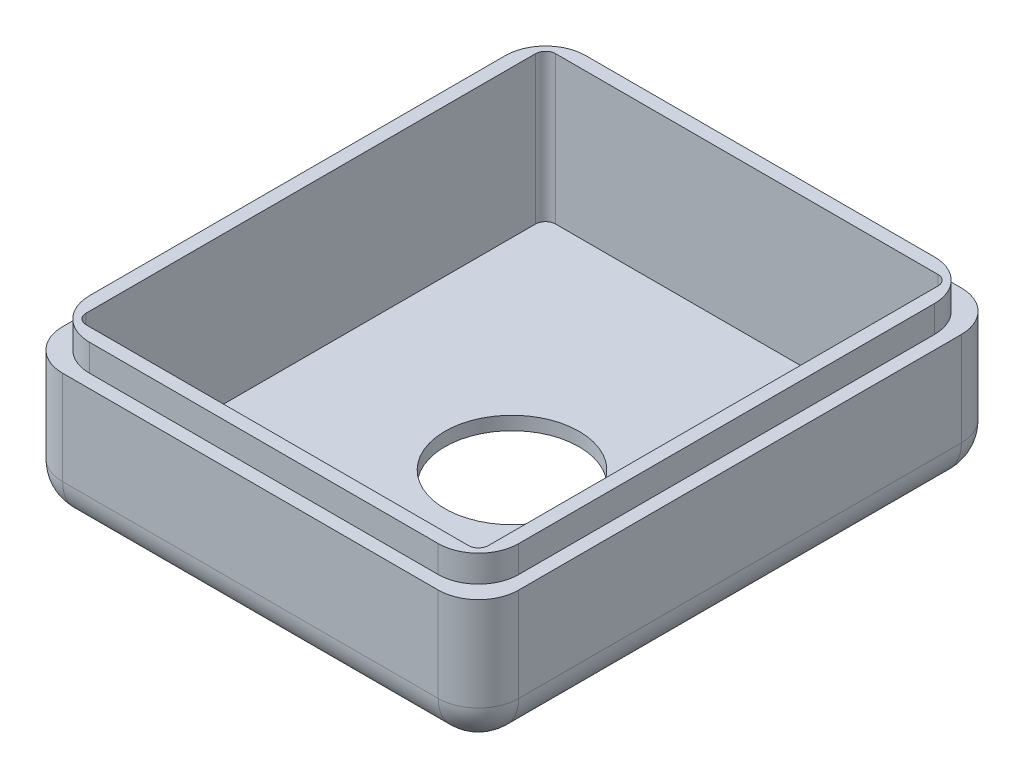
from build123d import *

# Parameters (mm, degrees)
SCHIZZO1_W                   = 34
SCHIZZO1_H                   = 39
ESTRUSIONE_ESTRUSIONE1_DEPTH = 10
SCHIZZO4_W                   = 32
SCHIZZO4_H                   = 37
ESTRUSIONE_ESTRUSIONE2_DEPTH = 2
SCHIZZO5_W                   = 30
SCHIZZO5_H                   = 35
TAGLIO_ESTRUSIONE2_DEPTH     = 11
RACCORDO1_R                  = 3
RACCORDO2_R                  = 0.75
TAGLIO_ESTRUSIONE3_REACH     = 47.879
SCHIZZO6_R                   = 5


with BuildPart() as part:
    # Schizzo1 → Estrusione-Estrusione1 (new body)
    with BuildSketch(Plane(origin=(0, 0, 0), x_dir=(1, 0, 0), z_dir=(0, 1, 0))):
        with Locations((-16.306007172, -9.682590788)):
            Rectangle(SCHIZZO1_W, SCHIZZO1_H)
    extrude(amount=ESTRUSIONE_ESTRUSIONE1_DEPTH)

    # Schizzo4 → Estrusione-Estrusione2 (add)
    with BuildSketch(Plane(origin=(0, 10, 0), x_dir=(1, 0, 0), z_dir=(0, 1, 0))):
        with Locations((-16.306007172, -9.682590788)):
            Rectangle(SCHIZZO4_W, SCHIZZO4_H)
    extrude(amount=ESTRUSIONE_ESTRUSIONE2_DEPTH)

    # Schizzo5 → Taglio-Estrusione2 (cut)
    with BuildSketch(Plane(origin=(0, 12, 0), x_dir=(1, 0, 0), z_dir=(0, 1, 0))):
        with Locations((-16.306007172, -9.682590788)):
            Rectangle(SCHIZZO5_W, SCHIZZO5_H)
    extrude(amount=-TAGLIO_ESTRUSIONE2_DEPTH, mode=Mode.SUBTRACT)

    # Raccordo1
    raccordo1_edges = [part.edges().sort_by_distance(p)[0] for p in [
        (-32.306007172, 11, -8.817409212),
        (-32.306007172, 11, 28.182590788),
        (-0.306007172, 11, 28.182590788),
        (-0.306007172, 11, -8.817409212),
        (-16.306007172, 0, -9.817409212),
        (0.693992828, 0, 9.682590788),
        (-16.306007172, 0, 29.182590788),
        (-33.306007172, 0, 9.682590788),
        (-33.306007172, 5, -9.817409212),
        (0.693992828, 5, -9.817409212),
        (0.693992828, 5, 29.182590788),
        (-33.306007172, 5, 29.182590788),
    ]]
    fillet(raccordo1_edges, radius=RACCORDO1_R)

    # Raccordo2
    raccordo2_edges = [part.edges().sort_by_distance(p)[0] for p in [
        (-31.306007172, 6.5, 27.182590788),
        (-31.306007172, 6.5, -7.817409212),
        (-1.306007172, 6.5, -7.817409212),
        (-1.306007172, 6.5, 27.182590788),
    ]]
    fillet(raccordo2_edges, radius=RACCORDO2_R)

    # Schizzo6 → Taglio-Estrusione3 (cut, up to next)
    with BuildSketch(Plane.XZ, mode=Mode.PRIVATE) as taglio_estrusione3_sk1:
        with Locations(Location((-16.306007172, 9.682590788, 0), (0, 0, 270))):
            Circle(SCHIZZO6_R)
    taglio_estrusione3_tool1 = extrude(taglio_estrusione3_sk1.sketch, amount=-TAGLIO_ESTRUSIONE3_REACH, mode=Mode.PRIVATE) & part.part
    add(taglio_estrusione3_tool1.solids().sort_by_distance((-16.306007, 0, 9.682591))[0], mode=Mode.SUBTRACT)


solid = part.part
